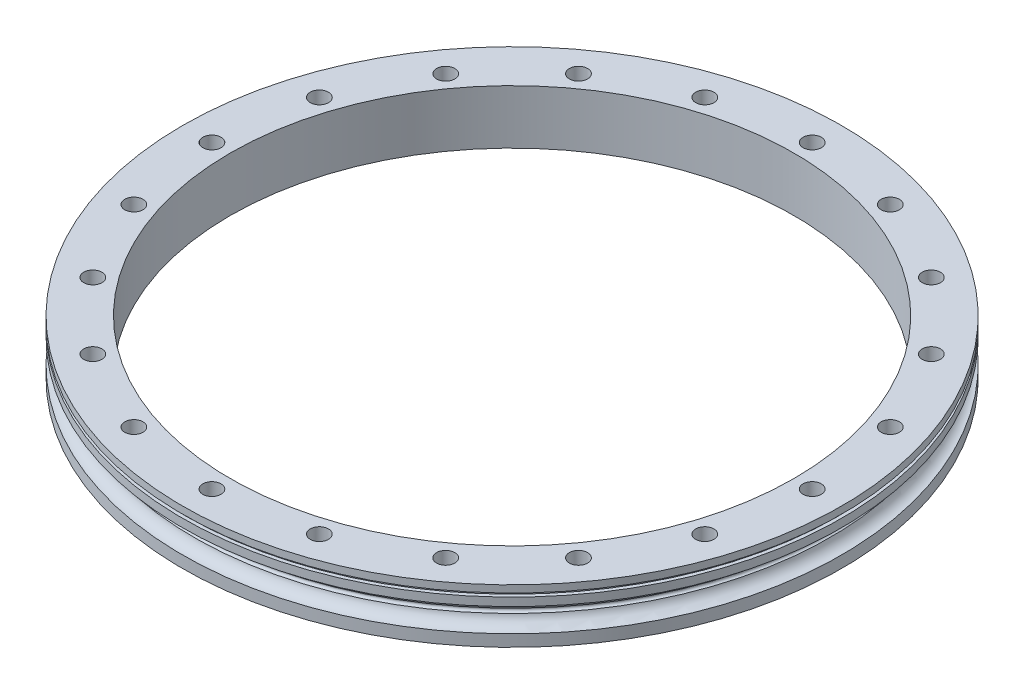
from build123d import *

# Parameters (mm, degrees)
ESQUISSE4_R                  = 7.75
ENL_V_MAT_EXTRU_2_DEPTH      = 399.642697161
R_P_TITION_CIRCULAIRE1_COUNT = 20


with BuildPart() as part:
    # Esquisse1 → Révolution1 (revolve)
    with BuildSketch(Plane.XY):
        with BuildLine():
            Line((-280, 46), (-280, 40))
            Line((-280, 40), (-277, 40))
            Line((-277, 40), (-277, 37))
            Line((-277, 37), (-280, 37))
            Line((-280, 37), (-280, 30))
            ThreePointArc((-280, 30), (-273.666348189, 27.738530528), (-270.197368421, 21.976970948))
            ThreePointArc((-270.197368421, 21.976970948), (-268.5, 20), (-270.197368421, 18.023029052))
            ThreePointArc((-270.197368421, 18.023029052), (-273.666348189, 12.261469472), (-280, 10))
            Line((-280, 10), (-280, 0))
            Line((-280, 0), (-239.5, 0))
            Line((-239.5, 0), (-239.5, 46))
            Line((-239.5, 46), (-280, 46))
        make_face()
    revolve(axis=Axis((0, 46, 0), (0, -1, 0)))

    # Esquisse4 → Enlèv. mat.-Extru.2 (cut, through all)
    with BuildSketch(Plane(origin=(0, 46, 0), x_dir=(1, 0, 0), z_dir=(0, 1, 0))):
        with Locations((-255, 0)):
            Circle(ESQUISSE4_R)
    enl_v_mat_extru_2 = extrude(amount=-ENL_V_MAT_EXTRU_2_DEPTH, mode=Mode.SUBTRACT)

    # Répétition circulaire1: Enlèv. mat.-Extru.2 ×20 about axis
    r_p_tition_circulaire1_axis = Axis((0, 45.15, 0), (0, -1, 0))
    for i in range(1, R_P_TITION_CIRCULAIRE1_COUNT):
        add(enl_v_mat_extru_2.rotate(r_p_tition_circulaire1_axis, i * 360 / R_P_TITION_CIRCULAIRE1_COUNT), mode=Mode.SUBTRACT)


solid = part.part
